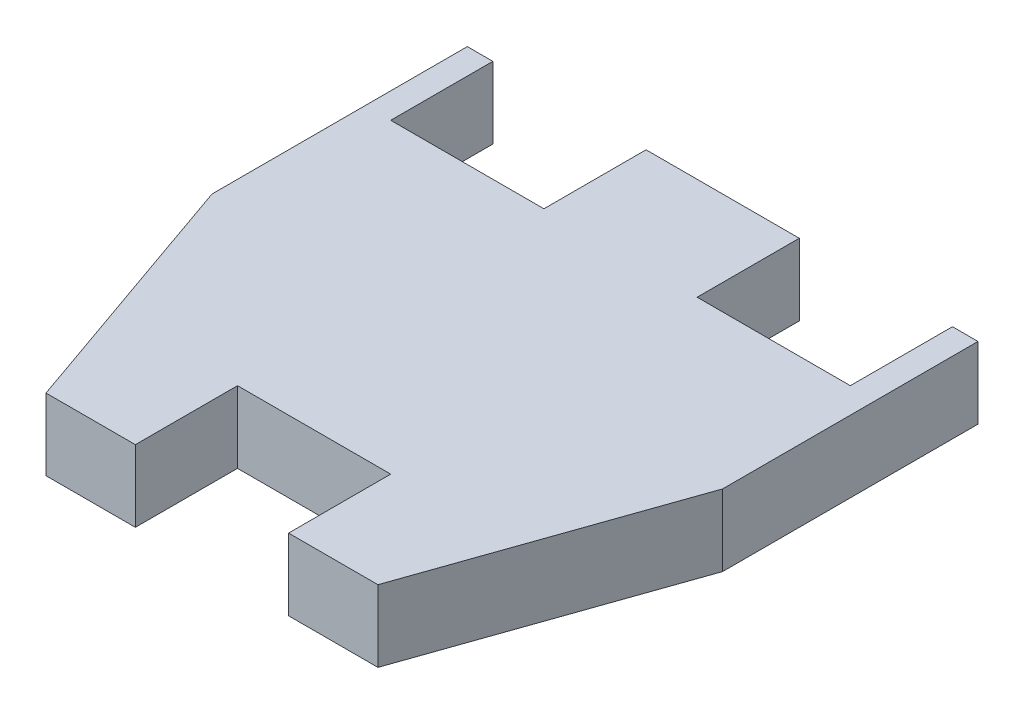
from build123d import *

# Parameters (mm, degrees)
BOSS_EXTRUDE1_DEPTH = 14.027771651
CUT_EXTRUDE1_DEPTH  = 16
CUT_EXTRUDE2_DEPTH  = 16


with BuildPart() as part:
    # Sketch1 → Boss-Extrude1 (new body)
    with BuildSketch(Plane(origin=(0, 0, 0), x_dir=(1, 0, 0), z_dir=(0, 1, 0))):
        Polygon((-45, 50), (-50, 50), (-50, -50), (-15, -50), (-15, -30), (15, -30), (15, -50), (50, -50), (50, 50), (45, 50), (45, 30), (15, 30), (15, 50), (-15, 50), (-15, 30), (-45, 30), align=None)
    extrude(amount=BOSS_EXTRUDE1_DEPTH)

    # Sketch2 → Revolve1 (revolve)
    with BuildSketch(Plane.ZY.offset(-15)):
        with BuildLine():
            Line((40.205231865, 11.565079329), (40.205231865, 1.565079329))
            ThreePointArc((40.205231865, 1.565079329), (35.205231865, 6.565079329), (40.205231865, 11.565079329))
        make_face()
    revolve(axis=Axis((15, 11.565079329, 40.205231865), (0, -1, 0)))

    # Sketch3 → Cut-Extrude1 (cut)
    with BuildSketch(Plane(origin=(0, 0, 0), x_dir=(1, 0, 0), z_dir=(0, 1, 0))):
        Polygon((-50, 0), (-32.5, -50), (-50, -50), align=None)
    extrude(amount=CUT_EXTRUDE1_DEPTH, mode=Mode.SUBTRACT)

    # Sketch4 → Cut-Extrude2 (cut)
    with BuildSketch(Plane(origin=(0, 0, 0), x_dir=(1, 0, 0), z_dir=(0, 1, 0))):
        Polygon((32.5, -50), (50, 0), (50, -50), align=None)
    extrude(amount=CUT_EXTRUDE2_DEPTH, mode=Mode.SUBTRACT)


solid = part.part
